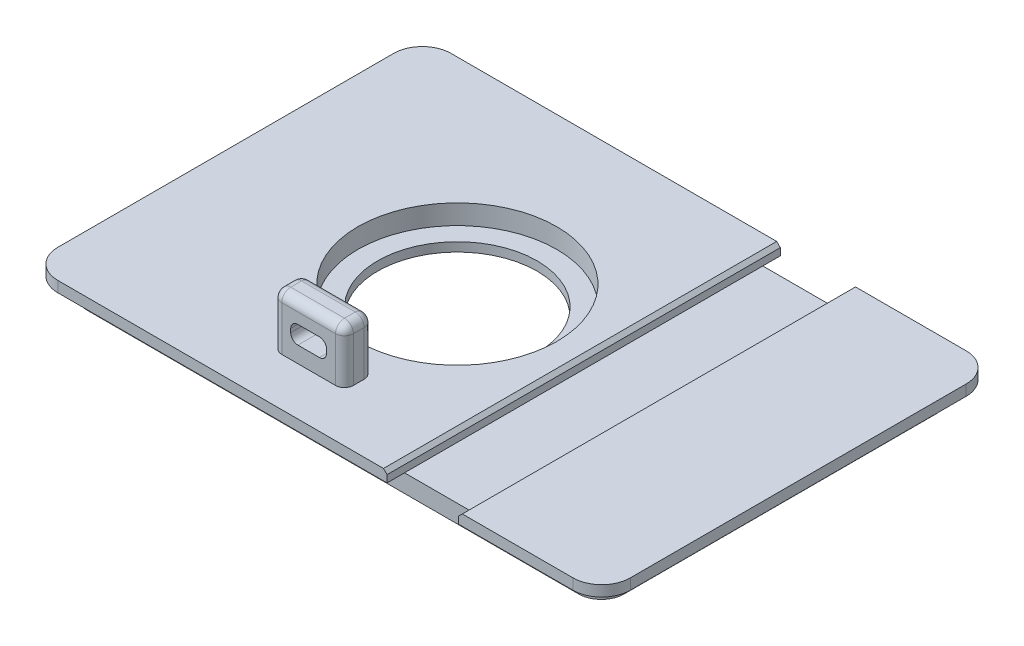
from build123d import *

# Parameters (mm, degrees)
EXTRUDE1_DEPTH          = 2.9972
EXTRUDE2_DEPTH          = 5.0038
SKETCH3_R               = 27.75
EXTRUDE3_DEPTH          = 5.5
SKETCH5_R               = 22.25
EXTRUDE4_DEPTH          = 98.06493798
CUT_EXTRUDE1_DEPTH      = 60
CUT_EXTRUDE1_DEPTH_BACK = 60
SKETCH6_W               = 20
SKETCH6_H               = 3
CHAMFER1_SIZE           = 1
SKETCH7_W               = 20
SKETCH7_H               = 8
BOSS_EXTRUDE1_DEPTH     = 15
FILLET1_R               = 2.5
CUT_EXTRUDE2_DEPTH      = 15


with BuildPart() as part:
    # Sketch1 → Extrude1 (new body)
    with BuildSketch(Plane(origin=(0, 0, 0), x_dir=(1, 0, 0), z_dir=(0, 1, 0))):
        with BuildLine():
            Line((-71.882, 54.864), (71.882, 54.864))
            ThreePointArc((71.882, 54.864), (77.539561356, 52.520561356), (79.883, 46.863))
            Line((79.883, 46.863), (79.883, -46.863))
            ThreePointArc((79.883, -46.863), (77.539561356, -52.520561356), (71.882, -54.864))
            Line((71.882, -54.864), (-71.882, -54.864))
            ThreePointArc((-71.882, -54.864), (-77.539561356, -52.520561356), (-79.883, -46.863))
            Line((-79.883, -46.863), (-79.883, 46.863))
            ThreePointArc((-79.883, 46.863), (-77.539561356, 52.520561356), (-71.882, 54.864))
        make_face()
    extrude(amount=EXTRUDE1_DEPTH)

    # Sketch2 → Extrude2 (add)
    with BuildSketch(Plane.XZ):
        with BuildLine():
            Line((68.58, -49.9872), (-68.58, -49.9872))
            ThreePointArc((-68.58, -49.9872), (-73.070128061, -48.127328061), (-74.93, -43.6372))
            Line((-74.93, -43.6372), (-74.93, 43.6372))
            ThreePointArc((-74.93, 43.6372), (-73.070128061, 48.127328061), (-68.58, 49.9872))
            Line((-68.58, 49.9872), (68.58, 49.9872))
            ThreePointArc((68.58, 49.9872), (73.070128061, 48.127328061), (74.93, 43.6372))
            Line((74.93, 43.6372), (74.93, -43.6372))
            ThreePointArc((74.93, -43.6372), (73.070128061, -48.127328061), (68.58, -49.9872))
        make_face()
    extrude(amount=EXTRUDE2_DEPTH)

    # Sketch3 → Extrude3 (cut)
    with BuildSketch(Plane(origin=(0, 2.9972, 0), x_dir=(1, 0, 0), z_dir=(0, 1, 0))):
        with Locations(Location((-15.25, 0, 0), (0, 0, 270))):
            Circle(SKETCH3_R)
    extrude(amount=-EXTRUDE3_DEPTH, mode=Mode.SUBTRACT)

    # Sketch5 → Extrude4 (cut, through all)
    with BuildSketch(Plane(origin=(0, -2.5028, 0), x_dir=(1, 0, 0), z_dir=(0, 1, 0))):
        with Locations(Location((-15.25, 0, 0), (0, 0, 270))):
            Circle(SKETCH5_R)
    extrude(amount=-EXTRUDE4_DEPTH, mode=Mode.SUBTRACT)

    # Sketch6 → Cut-Extrude1 (cut, two sides: drawn at the far end of the back side and taken through both)
    with BuildSketch(Plane.XY.offset(-CUT_EXTRUDE1_DEPTH_BACK)):
        with Locations((30, 1.5)):
            Rectangle(SKETCH6_W, SKETCH6_H)
    extrude(amount=CUT_EXTRUDE1_DEPTH + CUT_EXTRUDE1_DEPTH_BACK, mode=Mode.SUBTRACT)

    # Chamfer1
    chamfer1_edges = [part.edges().sort_by_distance(p)[0] for p in [
        (20, 2.9972, 0),
        (40, 2.9972, 0),
    ]]
    chamfer(chamfer1_edges, length=CHAMFER1_SIZE)

    # Sketch7 → Boss-Extrude1 (add)
    with BuildSketch(Plane(origin=(0, 2.9972, 0), x_dir=(1, 0, 0), z_dir=(0, 1, 0))):
        with Locations((-15.25, -37.5)):
            Rectangle(SKETCH7_W, SKETCH7_H)
    extrude(amount=BOSS_EXTRUDE1_DEPTH)

    # Fillet1
    fillet1_edges = [part.edges().sort_by_distance(p)[0] for p in [
        (-25.25, 10.4972, 33.5),
        (-25.25, 10.4972, 41.5),
        (-5.25, 10.4972, 41.5),
        (-5.25, 10.4972, 33.5),
        (-25.25, 17.9972, 37.5),
        (-15.25, 17.9972, 41.5),
        (-5.25, 17.9972, 37.5),
        (-15.25, 17.9972, 33.5),
    ]]
    fillet(fillet1_edges, radius=FILLET1_R)

    # Sketch8 → Cut-Extrude2 (cut)
    with BuildSketch(Plane(origin=(0, 0, 33.5), x_dir=(-1, 0, 0), z_dir=(0, 0, -1))):
        with BuildLine():
            Line((12.25, 12.5), (18.25, 12.5))
            ThreePointArc((18.25, 12.5), (19.664213562, 11.914213562), (20.25, 10.5))
            Line((20.25, 10.5), (20.25, 9.5))
            ThreePointArc((20.25, 9.5), (19.664213562, 8.085786438), (18.25, 7.5))
            Line((18.25, 7.5), (12.25, 7.5))
            ThreePointArc((12.25, 7.5), (10.835786438, 8.085786438), (10.25, 9.5))
            Line((10.25, 9.5), (10.25, 10.5))
            ThreePointArc((10.25, 10.5), (10.835786438, 11.914213562), (12.25, 12.5))
        make_face()
    extrude(amount=-CUT_EXTRUDE2_DEPTH, mode=Mode.SUBTRACT)


solid = part.part
